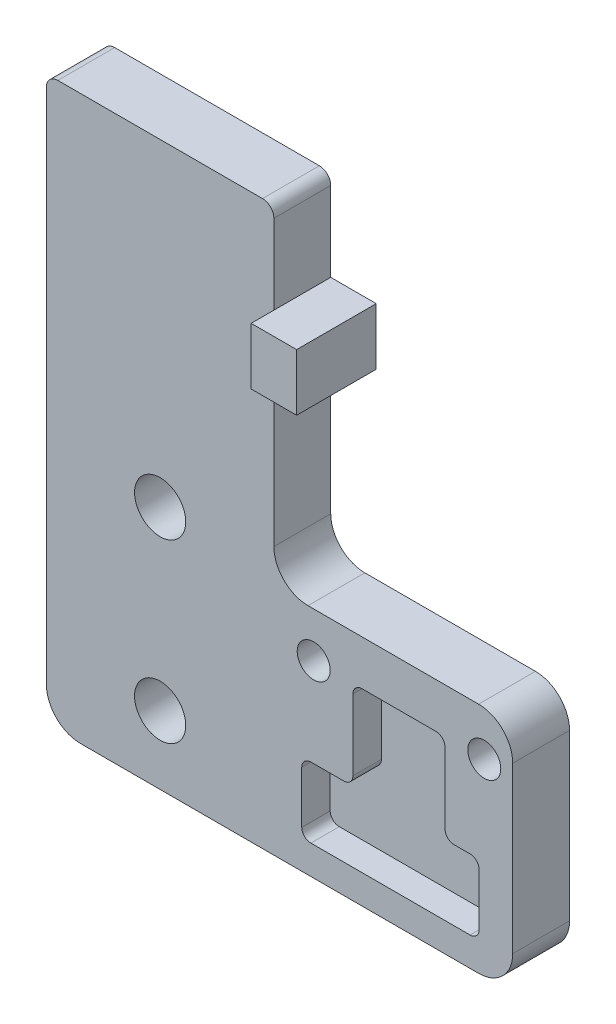
from build123d import *

# Parameters (mm, degrees)
CROQUIS1_W                          = 41
CROQUIS1_H                          = 49.5
SALIENTE_EXTRUIR1_DEPTH             = 5
CROQUIS2_W                          = 21
CROQUIS2_H                          = 29
CORTAR_EXTRUIR1_DEPTH               = 45.342417616
CROQUIS3_W                          = 5
CROQUIS3_H                          = 13
SALIENTE_EXTRUIR2_DEPTH             = 4
CROQUIS4_W                          = 4
CROQUIS4_H                          = 8
CORTAR_EXTRUIR2_DEPTH               = 45.342417616
CROQUIS5_W                          = 4
CROQUIS5_H                          = 5
SALIENTE_EXTRUIR3_DEPTH             = 2
CORTAR_EXTRUIR3_DEPTH               = 2.5
DI_METRO_DE_TALADRO_4_5_4_5_1_D     = 4.5
DI_METRO_DE_TALADRO_4_5_4_5_1_DEPTH = 7
DI_METRO_DE_TALADRO_2_9_2_9_1_D     = 2.9
DI_METRO_DE_TALADRO_2_9_2_9_1_DEPTH = 7
REDONDEO1_R                         = 0.8
REDONDEO2_R                         = 1
REDONDEO3_R                         = 3


with BuildPart() as part:
    # Croquis1 → Saliente-Extruir1 (new body)
    with BuildSketch(Plane.XY.offset(5)):
        with Locations((0, 14.25)):
            Rectangle(CROQUIS1_W, CROQUIS1_H)
    extrude(amount=-SALIENTE_EXTRUIR1_DEPTH)

    # Croquis2 → Cortar-Extruir1 (cut, through all)
    with BuildSketch(Plane.XY.offset(5)):
        with Locations((10, 24.5)):
            Rectangle(CROQUIS2_W, CROQUIS2_H)
    extrude(amount=-CORTAR_EXTRUIR1_DEPTH, mode=Mode.SUBTRACT)

    # Croquis3 → Saliente-Extruir2 (add)
    with BuildSketch(Plane(origin=(-0.5, 0, 0), x_dir=(0, 0, -1), z_dir=(1, 0, 0))):
        with Locations((-2.5, 32.5)):
            Rectangle(CROQUIS3_W, CROQUIS3_H)
    extrude(amount=SALIENTE_EXTRUIR2_DEPTH)

    # Croquis4 → Cortar-Extruir2 (cut, through all)
    with BuildSketch(Plane(origin=(0, 0, 0), x_dir=(-1, 0, 0), z_dir=(0, 0, -1))):
        with Locations((-1.5, 35)):
            Rectangle(CROQUIS4_W, CROQUIS4_H)
    extrude(amount=-CORTAR_EXTRUIR2_DEPTH, mode=Mode.SUBTRACT)

    # Croquis5 → Saliente-Extruir3 (add)
    with BuildSketch(Plane.XY.offset(5)):
        with Locations((1.5, 28.5)):
            Rectangle(CROQUIS5_W, CROQUIS5_H)
    extrude(amount=SALIENTE_EXTRUIR3_DEPTH)

    # Croquis6 → Cortar-Extruir3 (cut)
    with BuildSketch(Plane.XY.offset(5)):
        Polygon((17.55, -1.78), (14.55, -1.78), (14.55, 6.05), (6.45, 6.05), (6.45, -1.78), (1.95, -1.78), (1.95, -7.953122176), (17.55, -7.953122176), align=None)
    extrude(amount=-CORTAR_EXTRUIR3_DEPTH, mode=Mode.SUBTRACT)

    # Diámetro de taladro Ø4.5 (4.5)1
    with Locations(Plane(origin=(0, 0, 0), x_dir=(-1, 0, 0), z_dir=(0, 0, -1))):
        with Locations((10.5, 11), (10.5, -4.5)):
            Hole(DI_METRO_DE_TALADRO_4_5_4_5_1_D / 2, depth=DI_METRO_DE_TALADRO_4_5_4_5_1_DEPTH)

    # Diámetro de taladro Ø2.9 (2.9)1
    with Locations(Plane(origin=(0, 0, 0), x_dir=(-1, 0, 0), z_dir=(0, 0, -1))):
        with Locations((-3, 6.05), (-18, 6.05)):
            Hole(DI_METRO_DE_TALADRO_2_9_2_9_1_D / 2, depth=DI_METRO_DE_TALADRO_2_9_2_9_1_DEPTH)

    # Redondeo1
    redondeo1_edges = [part.edges().sort_by_distance(p)[0] for p in [
        (17.55, -1.78, 3.75),
        (17.55, -7.953122176, 3.75),
        (1.95, -7.953122176, 3.75),
        (1.95, -1.78, 3.75),
        (6.45, -1.78, 3.75),
        (6.45, 6.05, 3.75),
        (14.55, 6.05, 3.75),
        (14.55, -1.78, 3.75),
    ]]
    fillet(redondeo1_edges, radius=REDONDEO1_R)

    # Redondeo2
    redondeo2_edges = [part.edges().sort_by_distance(p)[0] for p in [
        (-0.5, 39, 2.5),
        (-20.5, 39, 2.5),
    ]]
    fillet(redondeo2_edges, radius=REDONDEO2_R)

    # Redondeo3
    redondeo3_edges = [part.edges().sort_by_distance(p)[0] for p in [
        (20.5, 10, 2.5),
        (-0.5, 10, 2.5),
        (-20.5, -10.5, 2.5),
        (20.5, -10.5, 2.5),
    ]]
    fillet(redondeo3_edges, radius=REDONDEO3_R)


solid = part.part
